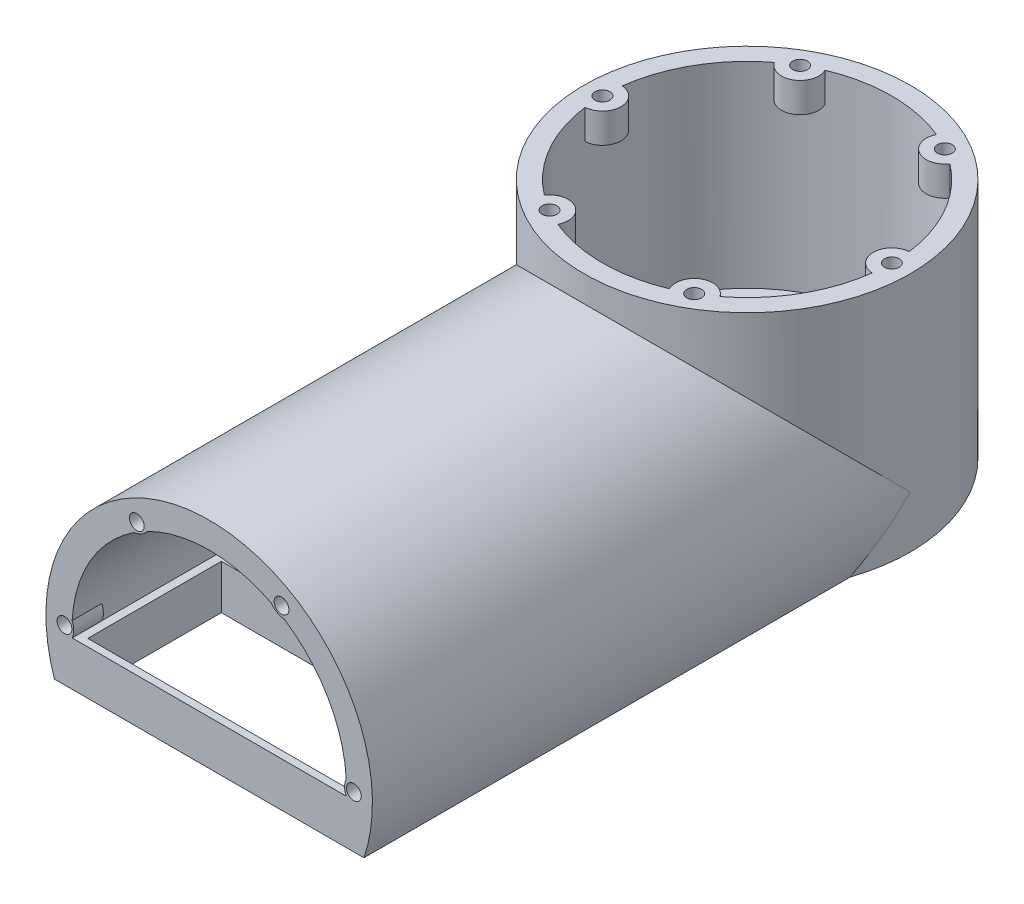
from build123d import *

# Parameters (mm, degrees)
CUT_EXTRUDE_START            = 7
SKETCH_9_R                   = 3
SKETCH_9_R_2                 = 1.5000000000000002
SKETCH_9_R_3                 = 1.5000000000001388
SKETCH_9_R_4                 = 1.5000000000003781
SKETCH_9_R_5                 = 1.5000000000002875
CUT_EXTRUDE_1_DEPTH          = 5
EXTRUDE_START                = -8
EXTRUDE_17_DEPTH             = 8
SKETCH_26_R                  = 2.000000000000003
CUT_EXTRUDE_12_DEPTH         = 5
PATTERN_CIRCULAR_3_COUNT     = 6
EXTRUDE_18_REACH             = 120.657
EXTRUDE_18_END_RADIUS        = 44
EXTRUDE_18_DIRECTION_2_DEPTH = 100
CUT_EXTRUDE_21_DEPTH         = 45
CUT_EXTRUDE_25_DEPTH         = 13
SKETCH_33_R                  = 2.0000000000000027
EXTRUDE_24_DEPTH             = 8
SKETCH_33_2_R                = 2.0000000000000027
CUT_EXTRUDE_23_DEPTH         = 7
PATTERN_CIRCULAR_4_COUNT     = 4
PATTERN_CIRCULAR_4_ANGLE     = 180.00000000000043
SKETCH_34_R                  = 2.5000000000000027
CUT_EXTRUDE_24_DEPTH         = 8


with BuildPart() as part:
    # Эскиз6 → Повернуть1 (revolve)
    with BuildSketch(Plane(origin=(0, 0, 0), x_dir=(0, 0, -1), z_dir=(1, 0, 0))):
        Polygon((26, 5.2e-15), (44, 0), (44.00000000000001, 64.97999999999999), (39.00000000000001, 64.97999999999996), (38.99999999999999, 12.000000000000005), (-3.9e-16, 12), (2.2e-16, 7), (26, 7.000000000000005), align=None)
    revolve(axis=Axis((0, 0, 0), (0, 1, 0)))

    # Эскиз9 → Вырез-Вытянуть1 (cut)
    with BuildSketch(Plane(origin=(0, 0, 0), x_dir=(1, 0, 0), z_dir=(0, 1, 0)).offset(CUT_EXTRUDE_START)):
        with Locations(Location((0, 0, 0), (0, 0, 270))):
            Circle(SKETCH_9_R)
        with Locations(Location((0, 7, 0), (0, 0, 270))):
            Circle(SKETCH_9_R_2)
        with Locations(Location((7.000000000000172, 1.7323e-13, 0), (0, 0, 270))):
            Circle(SKETCH_9_R_3)
        with Locations(Location((3.4645e-13, -7, 0), (0, 0, 270))):
            Circle(SKETCH_9_R_4)
        with Locations(Location((-6.999999999999828, -1.7408e-13, 0), (0, 0, 270))):
            Circle(SKETCH_9_R_5)
    extrude(amount=CUT_EXTRUDE_1_DEPTH, mode=Mode.SUBTRACT)

    # Эскиз25 → Бобышка-Вытянуть17 (add)
    with BuildSketch(Plane(origin=(0, 64.97999999999998, 0), x_dir=(1, 0, 0), z_dir=(0, 1, 0)).offset(EXTRUDE_START)):
        with BuildLine():
            ThreePointArc((-38.67948717948714, -4.9897165783128425), (-33.99999999999995, -2.3792e-13), (-38.67948717948721, 4.989716578312281))
            ThreePointArc((-38.67948717948721, 4.989716578312281), (-39, -2.8966e-13), (-38.67948717948714, -4.9897165783128425))
        make_face()
    extrude_17 = extrude(amount=EXTRUDE_17_DEPTH)

    # Эскиз26 → Вырез-Вытянуть12 (cut)
    with BuildSketch(Plane(origin=(0, 64.97999999999998, 0), x_dir=(1, 0, 0), z_dir=(0, 1, 0))):
        with Locations(Location((-38.99999999999999, -2.7234e-13, 0), (0, 0, 270))):
            Circle(SKETCH_26_R)
    cut_extrude_12 = extrude(amount=-CUT_EXTRUDE_12_DEPTH, mode=Mode.SUBTRACT)

    # Круговой массив3: Бобышка-Вытянуть17, Вырез-Вытянуть12 ×6 about axis
    pattern_circular_3_axis = Axis((1.44e-15, 0, -4.687e-14), (0, 1, 0))
    add([extrude_17.rotate(pattern_circular_3_axis, i * 360 / PATTERN_CIRCULAR_3_COUNT) for i in range(1, PATTERN_CIRCULAR_3_COUNT)])
    add([cut_extrude_12.rotate(pattern_circular_3_axis, i * 360 / PATTERN_CIRCULAR_3_COUNT) for i in range(1, PATTERN_CIRCULAR_3_COUNT)], mode=Mode.SUBTRACT)

    # Бобышка-Вытянуть18: up to this cylinder (the profile starts outside it)
    extrude_18_end = Plane(origin=(0, 1.051237, 0), z_dir=(0, -1, 0)) * Cylinder(EXTRUDE_18_END_RADIUS, 330.31399999999996, mode=Mode.PRIVATE)
    # Эскиз28 → Бобышка-Вытянуть18 (add, up to the surface)
    with BuildSketch(Plane.XY.offset(45), mode=Mode.PRIVATE) as extrude_18_sk1:
        with BuildLine():
            Line((-41.719138975825686, -0.00261217068331376), (41.719138975825686, -0.00261217068331376))
            ThreePointArc((41.719138975825686, -0.00261217068331376), (2.394e-14, 57.97999999999996), (-41.719138975825686, -0.00261217068331376))
        make_face()
        with BuildLine():
            Line((-36.94698363872211, 12), (36.94698363872211, 12))
            ThreePointArc((36.94698363872211, 12), (2.196e-14, 50.97999999999996), (-36.94698363872211, 12))
        make_face(mode=Mode.SUBTRACT)
    extrude_18_tool1 = extrude(extrude_18_sk1.sketch, amount=-EXTRUDE_18_REACH, mode=Mode.PRIVATE) - extrude_18_end
    add(extrude_18_tool1.solids().sort_by_distance((0, 1.051237, 45))[0])

    # Эскиз28 → Бобышка-Вытянуть18 direction 2 (add)
    with BuildSketch(Plane.XY.offset(45)):
        with BuildLine():
            Line((-41.719138975825686, -0.00261217068331376), (41.719138975825686, -0.00261217068331376))
            ThreePointArc((41.719138975825686, -0.00261217068331376), (2.394e-14, 57.97999999999996), (-41.719138975825686, -0.00261217068331376))
        make_face()
        with BuildLine():
            Line((-36.94698363872211, 12), (36.94698363872211, 12))
            ThreePointArc((36.94698363872211, 12), (2.196e-14, 50.97999999999996), (-36.94698363872211, 12))
        make_face(mode=Mode.SUBTRACT)
    extrude(amount=EXTRUDE_18_DIRECTION_2_DEPTH)

    # Эскиз29 → Вырез-Вытянуть21 (cut)
    with BuildSketch(Plane.XY.offset(45)):
        with BuildLine():
            Line((-36.94684355910066, 12), (36.946843559100685, 12))
            ThreePointArc((36.946843559100685, 12), (4.68e-15, 50.98261217068331), (-36.94684355910066, 12))
        make_face()
    extrude(amount=-CUT_EXTRUDE_21_DEPTH, mode=Mode.SUBTRACT)

    # Эскиз35 → Вырез-Вытянуть25 (cut)
    with BuildSketch(Plane.XZ.offset(0.00261217068331376)):
        Polygon((-34.719138975825686, 143.00000000000003), (-34.719138975825686, 107.00000000000001), (34.7191389758257, 107.00000000000003), (34.719138975825686, 143.00000000000003), align=None)
    extrude(amount=-CUT_EXTRUDE_25_DEPTH, mode=Mode.SUBTRACT)

    # Эскиз33 → Бобышка-Вытянуть24 (add)
    with BuildSketch(Plane.XY.offset(145.00000000000003)):
        with BuildLine():
            ThreePointArc((-41.17948717948977, 8.990283421687156), (-36.50000000000261, 13.97999999999975), (-41.17948717948984, 18.969716578312276))
            ThreePointArc((-41.17948717948984, 18.969716578312276), (-41.50000000000261, 13.979999999999722), (-41.17948717948977, 8.990283421687156))
        make_face()
        with Locations((-38.99999999999999, 13.979999999999986)):
            Circle(SKETCH_33_R, mode=Mode.SUBTRACT)
    extrude_24 = extrude(amount=-EXTRUDE_24_DEPTH)

    # Эскиз33<2> → Вырез-Вытянуть23 (cut)
    with BuildSketch(Plane.XY.offset(145.00000000000003)):
        with Locations((-38.99999999999999, 13.979999999999986)):
            Circle(SKETCH_33_2_R)
    cut_extrude_23 = extrude(amount=-CUT_EXTRUDE_23_DEPTH, mode=Mode.SUBTRACT)

    # Круговой массив4: Бобышка-Вытянуть24, Вырез-Вытянуть23 ×4 about axis
    pattern_circular_4_axis = Axis((1.187e-14, 13.980000000000057, 0), (0, 0, -1))
    add([extrude_24.rotate(pattern_circular_4_axis, i * PATTERN_CIRCULAR_4_ANGLE / (PATTERN_CIRCULAR_4_COUNT - 1)) for i in range(1, PATTERN_CIRCULAR_4_COUNT)])
    add([cut_extrude_23.rotate(pattern_circular_4_axis, i * PATTERN_CIRCULAR_4_ANGLE / (PATTERN_CIRCULAR_4_COUNT - 1)) for i in range(1, PATTERN_CIRCULAR_4_COUNT)], mode=Mode.SUBTRACT)

    # Эскиз34 → Вырез-Вытянуть24 (cut)
    with BuildSketch(Plane.XZ.offset(0.00261217068331376)):
        with Locations(Location((-38, 141, 0), (0, 0, 270))):
            Circle(SKETCH_34_R)
        with Locations(Location((-38, 109.00000000000001, 0), (0, 0, 270))):
            Circle(SKETCH_34_R)
        with Locations(Location((38, 141, 0), (0, 0, 270))):
            Circle(SKETCH_34_R)
        with Locations(Location((38.000000000000014, 109.00000000000003, 0), (0, 0, 270))):
            Circle(SKETCH_34_R)
    extrude(amount=-CUT_EXTRUDE_24_DEPTH, mode=Mode.SUBTRACT)


solid = part.part
